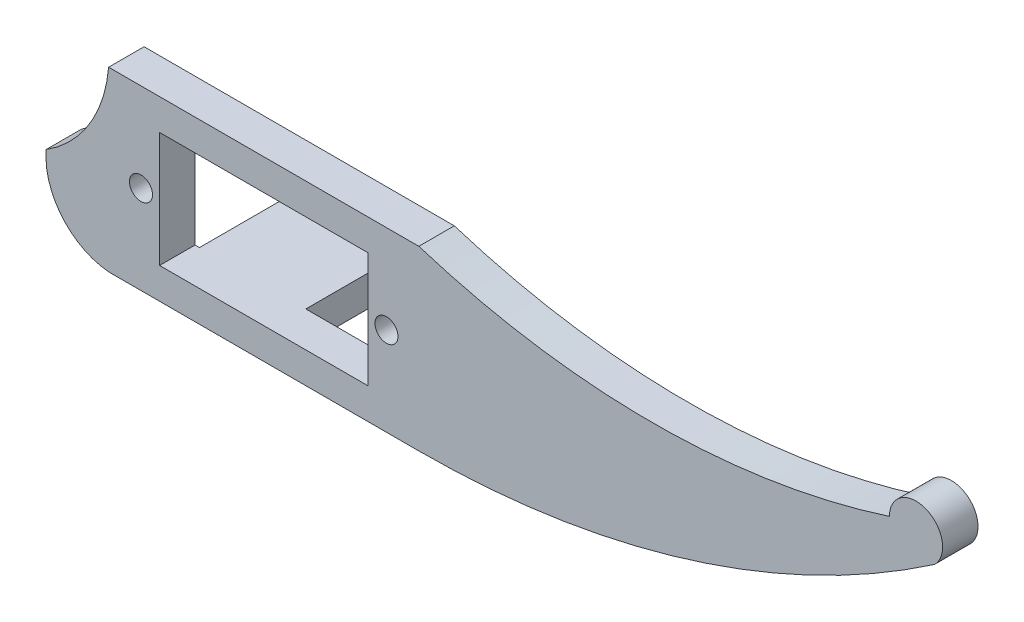
from build123d import *

# Parameters (mm, degrees)
SKETCH1_W           = 23.5
SKETCH1_H           = 13
BOSS_EXTRUDE1_DEPTH = 4
SKETCH4_W           = 12
SKETCH4_H           = 3.5
BOSS_EXTRUDE3_DEPTH = 12
SKETCH5_R           = 0.8
CUT_EXTRUDE2_DEPTH  = 3
SKETCH6_R           = 1.3
CUT_EXTRUDE3_DEPTH  = 4


with BuildPart() as part:
    # Sketch1 → Boss-Extrude1 (new body)
    with BuildSketch(Plane.XY):
        with BuildLine():
            Line((24.860467777, 7.362362669), (-10.139532223, 7.362362669))
            ThreePointArc((-10.139532223, 7.362362669), (-12.294111981, 0.751764817), (-17.178188495, -4.196771785))
            ThreePointArc((-17.178188495, -4.196771785), (-15.407020853, -9.874958003), (-10.139532223, -12.637637331))
            Line((-10.139532223, -12.637637331), (24.860467777, -12.637637331))
            ThreePointArc((24.860467777, -12.637637331), (54.82087059, -8.185603487), (82.192202879, 4.785769252))
            ThreePointArc((82.192202879, 4.785769252), (82.614789286, 5.070273598), (83.035963889, 5.356863806))
            ThreePointArc((83.035963889, 5.356863806), (82.132298227, 10.279823625), (77.956940726, 7.519654292))
            ThreePointArc((77.956940726, 7.519654292), (51.420959061, 3.304188228), (24.860467777, 7.362362669))
        make_face()
        with Locations((7.360467777, -2.637637331)):
            Rectangle(SKETCH1_W, SKETCH1_H, mode=Mode.SUBTRACT)
    extrude(amount=BOSS_EXTRUDE1_DEPTH)

    # Sketch4 → Boss-Extrude3 (add)
    with BuildSketch(Plane(origin=(0, 0, 0), x_dir=(-1, 0, 0), z_dir=(0, 0, -1))):
        with Locations((-2.110467777, -10.887637331)):
            Rectangle(SKETCH4_W, SKETCH4_H)
    extrude(amount=BOSS_EXTRUDE3_DEPTH)

    # Sketch5 → Cut-Extrude2 (cut)
    with BuildSketch(Plane(origin=(0, 0, -12), x_dir=(-1, 0, 0), z_dir=(0, 0, -1))):
        with Locations((0.889532223, -10.887637331)):
            Circle(SKETCH5_R)
        with Locations((-5.110467777, -10.887637331)):
            Circle(SKETCH5_R)
    extrude(amount=-CUT_EXTRUDE2_DEPTH, mode=Mode.SUBTRACT)

    # Sketch6 → Cut-Extrude3 (cut)
    with BuildSketch(Plane.XY.offset(4)):
        with Locations((21.210467777, -2.637637331)):
            Circle(SKETCH6_R)
        with Locations((-6.489532223, -2.637637331)):
            Circle(SKETCH6_R)
    extrude(amount=-CUT_EXTRUDE3_DEPTH, mode=Mode.SUBTRACT)


solid = part.part
